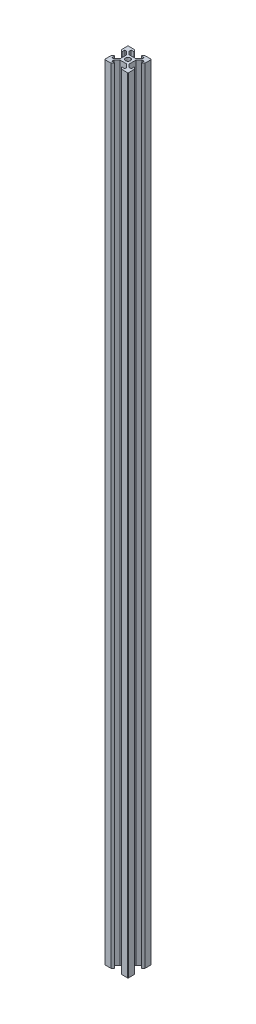
from build123d import *

# Parameters (mm, degrees)
SKETCH1_R             = 2.074585303
BOSS_EXTRUDE2_DEPTH   = 1000
CROQUIS1_W            = 21.960617296
CROQUIS1_H            = 22.681220878
CORTAR_EXTRUIR1_DEPTH = 334


with BuildPart() as part:
    # Sketch1 → Boss-Extrude2 (new body)
    with BuildSketch(Plane(origin=(0, 0, 0), x_dir=(1, 0, 0), z_dir=(0, 1, 0))):
        with BuildLine():
            Line((6.1, 12.845), (6.1, 7.149086807))
            Line((6.1, 7.149086807), (3.439339828, 4.5))
            Line((3.439339828, 4.5), (1.8, 4.5))
            Line((1.8, 4.5), (1.8, 6.88))
            Line((1.8, 6.88), (1.46, 6.88))
            Line((1.46, 6.88), (0, 5.42))
            Line((0, 5.42), (0, 0.5))
            ThreePointArc((0, 0.5), (0.146446609, 0.146446609), (0.5, 0))
            Line((0.5, 0), (5.42, 0))
            Line((5.42, 0), (6.875, 1.455))
            Line((6.875, 1.455), (6.875, 1.8))
            Line((6.875, 1.8), (4.5, 1.8))
            Line((4.5, 1.8), (4.5, 3.4393348))
            Line((4.5, 3.4393348), (7.158345795, 6.086117297))
            Line((7.158345795, 6.086117297), (7.144523479, 6.1))
            Line((7.144523479, 6.1), (12.854625295, 6.1))
            Line((12.854625295, 6.1), (12.841221344, 6.086548451))
            Line((12.841221344, 6.086548451), (15.499715, 3.437461644))
            Line((15.499715, 3.437461644), (15.5, 3.437747657))
            Line((15.5, 3.437747657), (15.5, 1.8))
            Line((15.5, 1.8), (13.12, 1.8))
            Line((13.12, 1.8), (13.12, 1.455))
            Line((13.12, 1.455), (14.575, 0))
            Line((14.575, 0), (19.5, 0))
            ThreePointArc((19.5, 0), (19.853553391, 0.146446609), (20, 0.5))
            Line((20, 0.5), (20, 5.42))
            Line((20, 5.42), (18.606904708, 6.88))
            Line((18.606904708, 6.88), (18.2, 6.88))
            Line((18.2, 6.88), (18.2, 4.5))
            Line((18.2, 4.5), (16.558493656, 4.5))
            Line((16.558493656, 4.5), (13.9, 7.149086807))
            Line((13.9, 7.149086807), (13.9, 12.844511469))
            Line((13.9, 12.844511469), (16.558493656, 15.492177728))
            Line((16.558493656, 15.492177728), (16.550703242, 15.5))
            Line((16.550703242, 15.5), (18.2, 15.5))
            Line((18.2, 15.5), (18.2, 13.12))
            Line((18.2, 13.12), (18.534428266, 13.12))
            Line((18.534428266, 13.12), (20, 14.58))
            Line((20, 14.58), (20, 19.5))
            ThreePointArc((20, 19.5), (19.853553391, 19.853553391), (19.5, 20))
            Line((19.5, 20), (14.575, 20))
            Line((14.575, 20), (13.12, 18.545))
            Line((13.12, 18.545), (13.12, 18.2))
            Line((13.12, 18.2), (15.5, 18.2))
            Line((15.5, 18.2), (15.5, 16.555))
            Line((15.5, 16.555), (12.834142613, 13.9))
            Line((12.834142613, 13.9), (7.155, 13.9))
            Line((7.155, 13.9), (4.5, 16.555))
            Line((4.5, 16.555), (4.5, 18.2))
            Line((4.5, 18.2), (6.875, 18.2))
            Line((6.875, 18.2), (6.875, 18.545))
            Line((6.875, 18.545), (5.42, 20))
            Line((5.42, 20), (0.5, 20))
            ThreePointArc((0.5, 20), (0.146446609, 19.853553391), (0, 19.5))
            Line((0, 19.5), (0, 14.58))
            Line((0, 14.58), (1.46, 13.12))
            Line((1.46, 13.12), (1.8, 13.12))
            Line((1.8, 13.12), (1.8, 15.5))
            Line((1.8, 15.5), (3.445, 15.5))
            Line((3.445, 15.5), (3.439339828, 15.494339828))
            Line((3.439339828, 15.494339828), (6.094339828, 12.839339828))
            Line((6.094339828, 12.839339828), (6.1, 12.845))
        make_face()
        with Locations((10, 10)):
            Circle(SKETCH1_R, mode=Mode.SUBTRACT)
    extrude(amount=BOSS_EXTRUDE2_DEPTH)

    # Croquis1 → Cortar-Extruir1 (cut)
    with BuildSketch(Plane(origin=(0, 1000, 0), x_dir=(1, 0, 0), z_dir=(0, 1, 0))):
        with Locations((10, 10)):
            Rectangle(CROQUIS1_W, CROQUIS1_H)
    extrude(amount=-CORTAR_EXTRUIR1_DEPTH, mode=Mode.SUBTRACT)


solid = part.part
